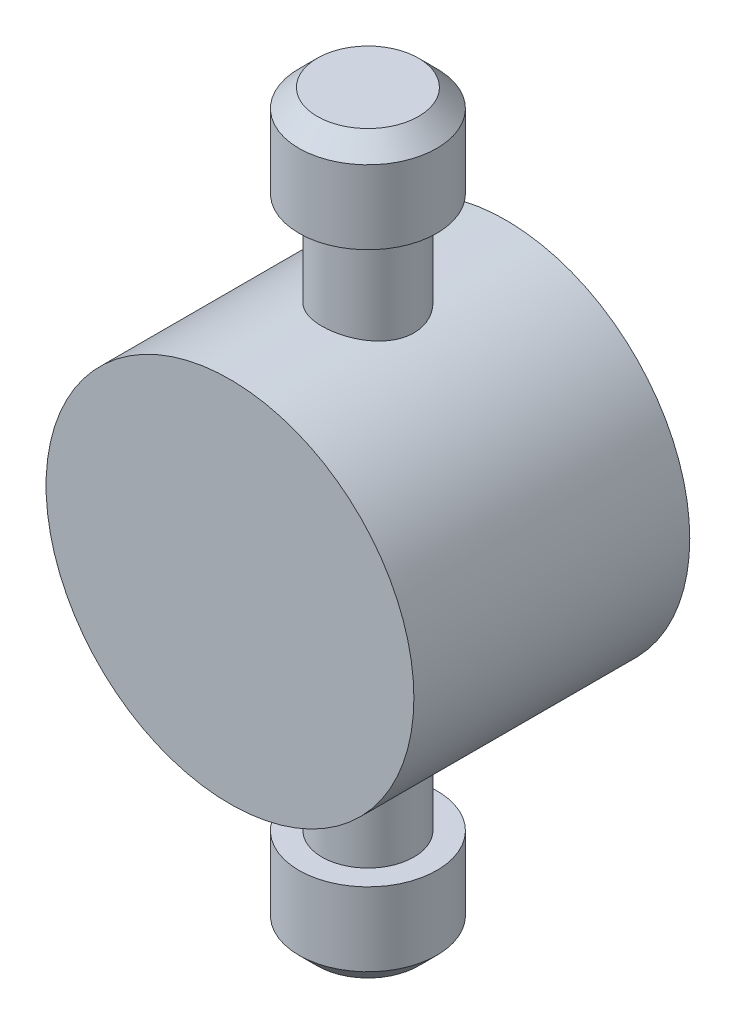
from build123d import *

# Parameters (mm, degrees)
SKETCH1_R                = 20
BOSS_EXTRUDE1_DEPTH      = 15
SKETCH2_R                = 7.5
BOSS_EXTRUDE2_DEPTH      = 10
BOSS_EXTRUDE3_REACH      = 57.902
BOSS_EXTRUDE3_END_RADIUS = 20
SKETCH3_R                = 5
CHAMFER1_SIZE            = 2
SKETCH4_R                = 5
CUT_EXTRUDE1_DEPTH       = 10


with BuildPart() as part:
    # Sketch1 → Boss-Extrude1 (new, symmetric)
    with BuildSketch(Plane.XY):
        Circle(SKETCH1_R)
    extrude(amount=BOSS_EXTRUDE1_DEPTH, both=True)



with BuildPart() as body_2:
    # Sketch2 → Boss-Extrude2 (new body)
    with BuildSketch(Plane(origin=(0, 40, 0), x_dir=(1, 0, 0), z_dir=(0, 1, 0))):
        with Locations(Location((0, 0, 0), (0, 0, 270))):
            Circle(SKETCH2_R)
    extrude(amount=-BOSS_EXTRUDE2_DEPTH)


with BuildPart() as part_1:
    add(part.part)

    add(body_2.part)  # Boss-Extrude3 merges body 2
    # Boss-Extrude3: up to this cylinder (the profile starts outside it)
    boss_extrude3_end = Plane(origin=(0, 0, 0), z_dir=(0, 0, -1)) * Cylinder(BOSS_EXTRUDE3_END_RADIUS, 156.804, mode=Mode.PRIVATE)
    # Sketch3 → Boss-Extrude3 (add, up to the surface)
    with BuildSketch(Plane.XZ.offset(-30), mode=Mode.PRIVATE) as boss_extrude3_sk1:
        with Locations(Location((0, 0, 0), (0, 0, 90))):
            Circle(SKETCH3_R)
    boss_extrude3_tool1 = extrude(boss_extrude3_sk1.sketch, amount=BOSS_EXTRUDE3_REACH, mode=Mode.PRIVATE) - boss_extrude3_end
    add(boss_extrude3_tool1.solids().sort_by_distance((0, 30, 0))[0])

    # Chamfer1
    chamfer1_edges = [part_1.edges().sort_by_distance(p)[0] for p in [
        (0, 40, -7.5),
    ]]
    chamfer(chamfer1_edges, length=CHAMFER1_SIZE)

    # Mirror21: part across plane


with BuildPart() as part_2:
    add(part_1.part)
    add(part_1.part.mirror(Plane.ZX))

    # Sketch4 → Cut-Extrude1 (cut)
    with BuildSketch(Plane(origin=(0, 0, -15), x_dir=(-1, 0, 0), z_dir=(0, 0, -1))):
        Circle(SKETCH4_R)
    extrude(amount=-CUT_EXTRUDE1_DEPTH, mode=Mode.SUBTRACT)


solid = part_2.part
